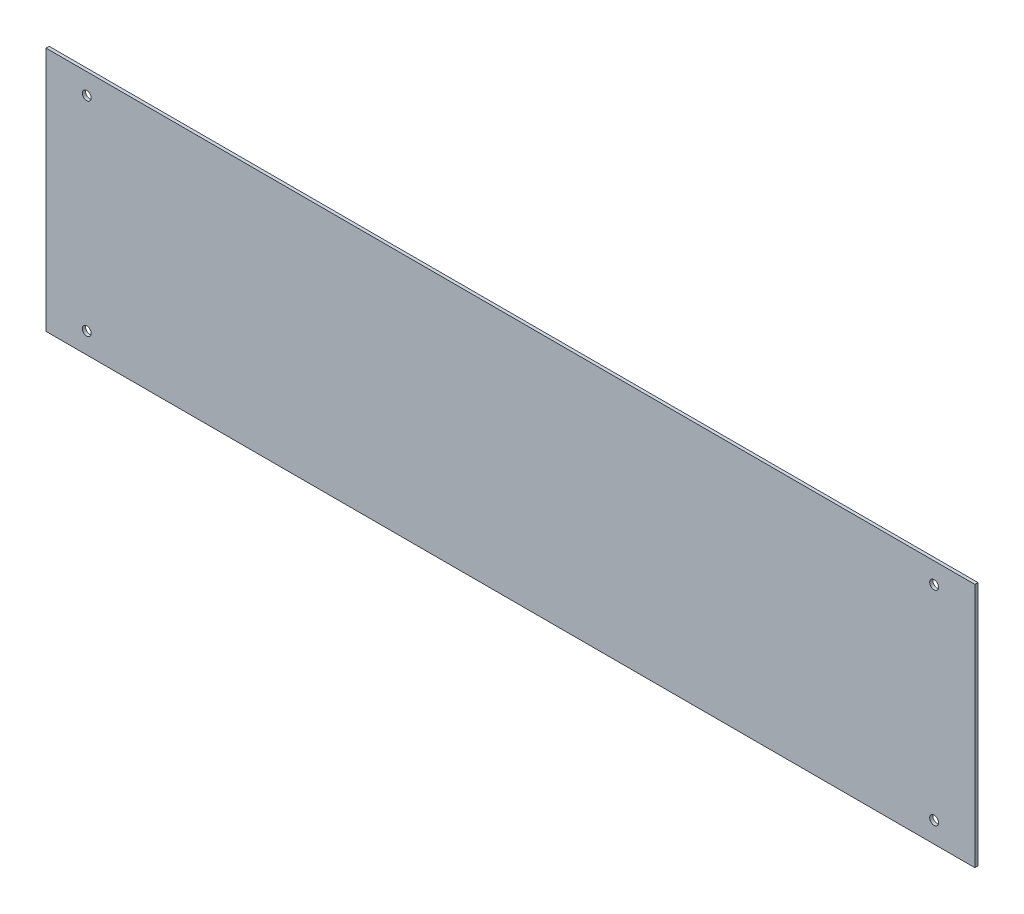
from build123d import *

# Parameters (mm, degrees)
SKETCH1_W            = 470.834
SKETCH1_H            = 124.378
SKETCH1_R            = 1.349174791
SKETCH1_R_2          = 1.283013689
SKETCH1_R_3          = 1.369737485
SKETCH1_R_4          = 1.484366509
BOSS_EXTRUDE1_DEPTH  = 1.5875
M4_CLEARANCE_HOLE1_D = 4.5


with BuildPart() as part:
    # Sketch1 → Boss-Extrude1 (new body)
    with BuildSketch(Plane.XY):
        with Locations((250.453582273, -342.404352818)):
            Rectangle(SKETCH1_W, SKETCH1_H)
        with Locations((465.210582273, -290.725352818)):
            Circle(SKETCH1_R, mode=Mode.SUBTRACT)
        with Locations((465.210582273, -394.083352818)):
            Circle(SKETCH1_R_2, mode=Mode.SUBTRACT)
        with Locations((35.696582273, -290.725352818)):
            Circle(SKETCH1_R_3, mode=Mode.SUBTRACT)
        with Locations((35.696582273, -394.083352818)):
            Circle(SKETCH1_R_4, mode=Mode.SUBTRACT)
    extrude(amount=BOSS_EXTRUDE1_DEPTH)

    # M4 Clearance Hole1 (through all)
    with Locations(Plane.XY.offset(1.5875)):
        with Locations((35.696582273, -290.725352818), (35.696582273, -394.083352818), (465.210582273, -290.725352818), (465.210582273, -394.083352818)):
            Hole(M4_CLEARANCE_HOLE1_D / 2)


solid = part.part
